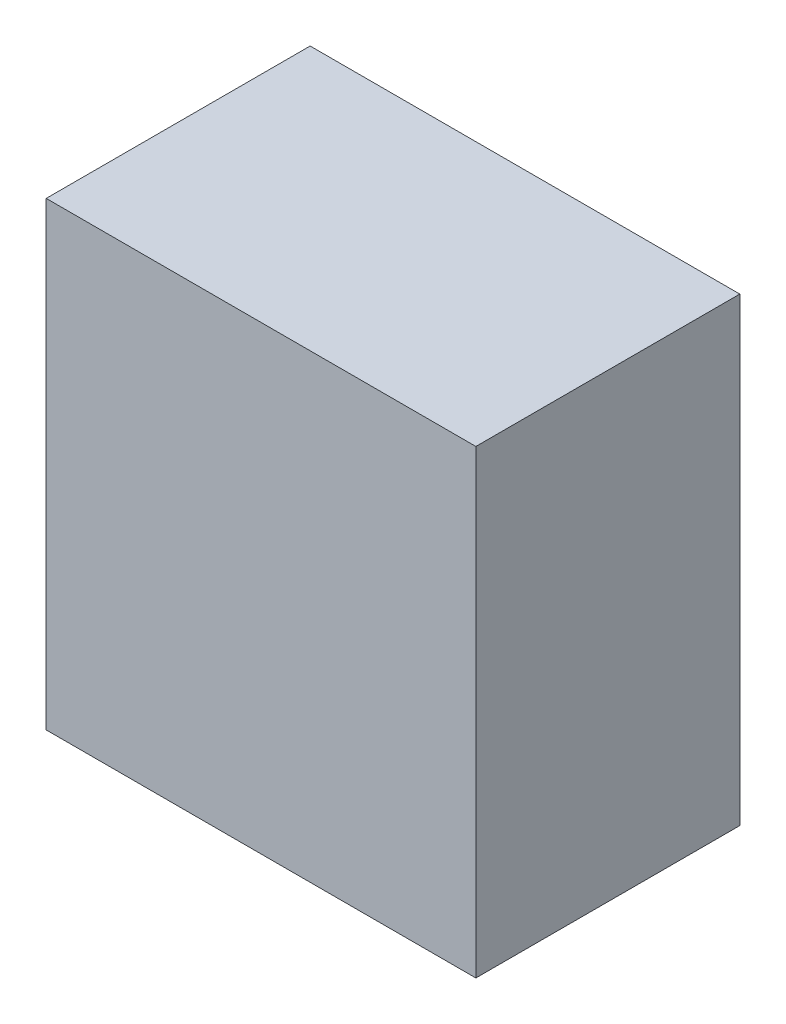
from build123d import *

# Parameters (mm, degrees)
SKETCH_1_W                = 86
SKETCH_1_H                = 150
EXTRUDE_1_DEPTH           = 140
HOLE_WIZARD_3_0_3_1_D     = 3
HOLE_WIZARD_3_0_3_1_DEPTH = 5
HOLE_WIZARD_3_0_3_1_TIP   = 0.901290929


with BuildPart() as part:
    # Эскиз1 → Бобышка-Вытянуть1 (new body)
    with BuildSketch(Plane(origin=(0, 0, 0), x_dir=(0, 0, -1), z_dir=(1, 0, 0))):
        with Locations((43, 75)):
            Rectangle(SKETCH_1_W, SKETCH_1_H)
    extrude(amount=EXTRUDE_1_DEPTH)

    # Диаметр отверстия Ø3.0 (3)1
    with Locations(Plane.ZY):
        with Locations((-80, 144), (-6, 120), (-16, 6), (-80, 6)):
            Hole(HOLE_WIZARD_3_0_3_1_D / 2, depth=HOLE_WIZARD_3_0_3_1_DEPTH)
            with Locations((0, 0, -(HOLE_WIZARD_3_0_3_1_DEPTH + HOLE_WIZARD_3_0_3_1_TIP / 2))):  # 118° drill point
                Cone(0, HOLE_WIZARD_3_0_3_1_D / 2, HOLE_WIZARD_3_0_3_1_TIP, mode=Mode.SUBTRACT)


solid = part.part
